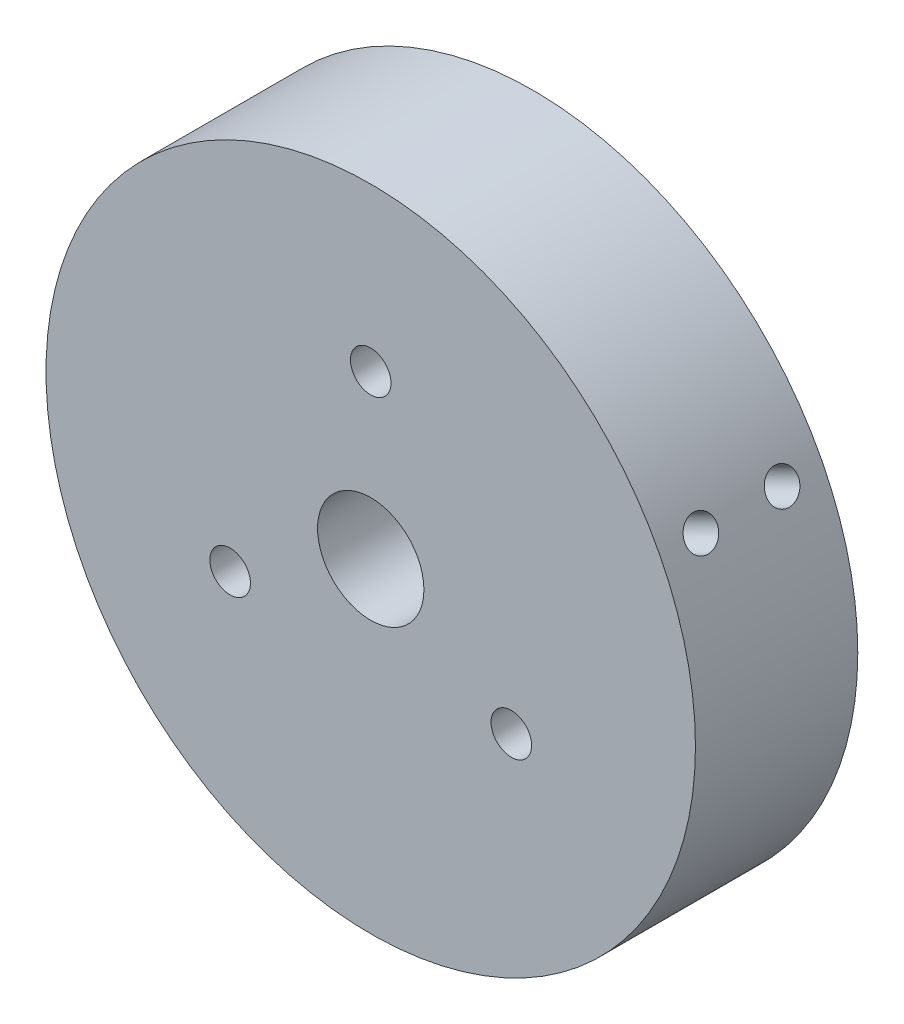
from build123d import *

# Parameters (mm, degrees)
SKETCH1_R                      = 20
SKETCH1_R_2                    = 1.250479472
SKETCH1_R_3                    = 3.275
BOSS_EXTRUDE1_DEPTH            = 10
CUT_EXTRUDE2_REACH             = 41.275
SKETCH4_R                      = 1
CUT_EXTRUDE2_DIRECTION_2_REACH = 41.275


with BuildPart() as part:
    # Sketch1 → Boss-Extrude1 (new body)
    with BuildSketch(Plane.XY):
        Circle(SKETCH1_R)
        with Locations((0, 10)):
            Circle(SKETCH1_R_2, mode=Mode.SUBTRACT)
        Circle(SKETCH1_R_3, mode=Mode.SUBTRACT)
        with Locations((8.660254038, -5)):
            Circle(SKETCH1_R_2, mode=Mode.SUBTRACT)
        with Locations((-8.660254038, -5)):
            Circle(SKETCH1_R_2, mode=Mode.SUBTRACT)
    extrude(amount=BOSS_EXTRUDE1_DEPTH)

    # Sketch4 → Cut-Extrude2 (cut, up to next)
    with BuildSketch(Plane(origin=(8.979891602, 4.550503837, 0), x_dir=(0.4520194972044375, -0.8920080572209242, 0), z_dir=(-0.8920080572209242, -0.4520194972044375, 0)), mode=Mode.PRIVATE) as cut_extrude2_sk1:
        with Locations((0, 7.5)):
            Circle(SKETCH4_R)
    cut_extrude2_tool1 = extrude(cut_extrude2_sk1.sketch, amount=-CUT_EXTRUDE2_REACH, mode=Mode.PRIVATE) & part.part
    # Sketch4 → Cut-Extrude2 (cut, up to next)
    with BuildSketch(Plane(origin=(8.979891602, 4.550503837, 0), x_dir=(0.4520194972044375, -0.8920080572209242, 0), z_dir=(-0.8920080572209242, -0.4520194972044375, 0)), mode=Mode.PRIVATE) as cut_extrude2_sk2:
        with Locations((0, 2.5)):
            Circle(SKETCH4_R)
    cut_extrude2_tool2 = extrude(cut_extrude2_sk2.sketch, amount=-CUT_EXTRUDE2_REACH, mode=Mode.PRIVATE) & part.part
    add(cut_extrude2_tool1.solids().sort_by_distance((8.979892, 4.550504, 7.5))[0], mode=Mode.SUBTRACT)
    add(cut_extrude2_tool2.solids().sort_by_distance((8.979892, 4.550504, 2.5))[0], mode=Mode.SUBTRACT)

    # Sketch4 → Cut-Extrude2 direction 2 (cut, up to next)
    with BuildSketch(Plane(origin=(8.979891602, 4.550503837, 0), x_dir=(0.4520194972044375, -0.8920080572209242, 0), z_dir=(-0.8920080572209242, -0.4520194972044375, 0)), mode=Mode.PRIVATE) as cut_extrude2_direction_2_sk1:
        with Locations((0, 7.5)):
            Circle(SKETCH4_R)
    cut_extrude2_direction_2_tool1 = extrude(cut_extrude2_direction_2_sk1.sketch, amount=CUT_EXTRUDE2_DIRECTION_2_REACH, mode=Mode.PRIVATE) & part.part
    # Sketch4 → Cut-Extrude2 direction 2 (cut, up to next)
    with BuildSketch(Plane(origin=(8.979891602, 4.550503837, 0), x_dir=(0.4520194972044375, -0.8920080572209242, 0), z_dir=(-0.8920080572209242, -0.4520194972044375, 0)), mode=Mode.PRIVATE) as cut_extrude2_direction_2_sk2:
        with Locations((0, 2.5)):
            Circle(SKETCH4_R)
    cut_extrude2_direction_2_tool2 = extrude(cut_extrude2_direction_2_sk2.sketch, amount=CUT_EXTRUDE2_DIRECTION_2_REACH, mode=Mode.PRIVATE) & part.part
    add(cut_extrude2_direction_2_tool1.solids().sort_by_distance((8.979892, 4.550504, 7.5))[0], mode=Mode.SUBTRACT)
    add(cut_extrude2_direction_2_tool2.solids().sort_by_distance((8.979892, 4.550504, 2.5))[0], mode=Mode.SUBTRACT)


solid = part.part
